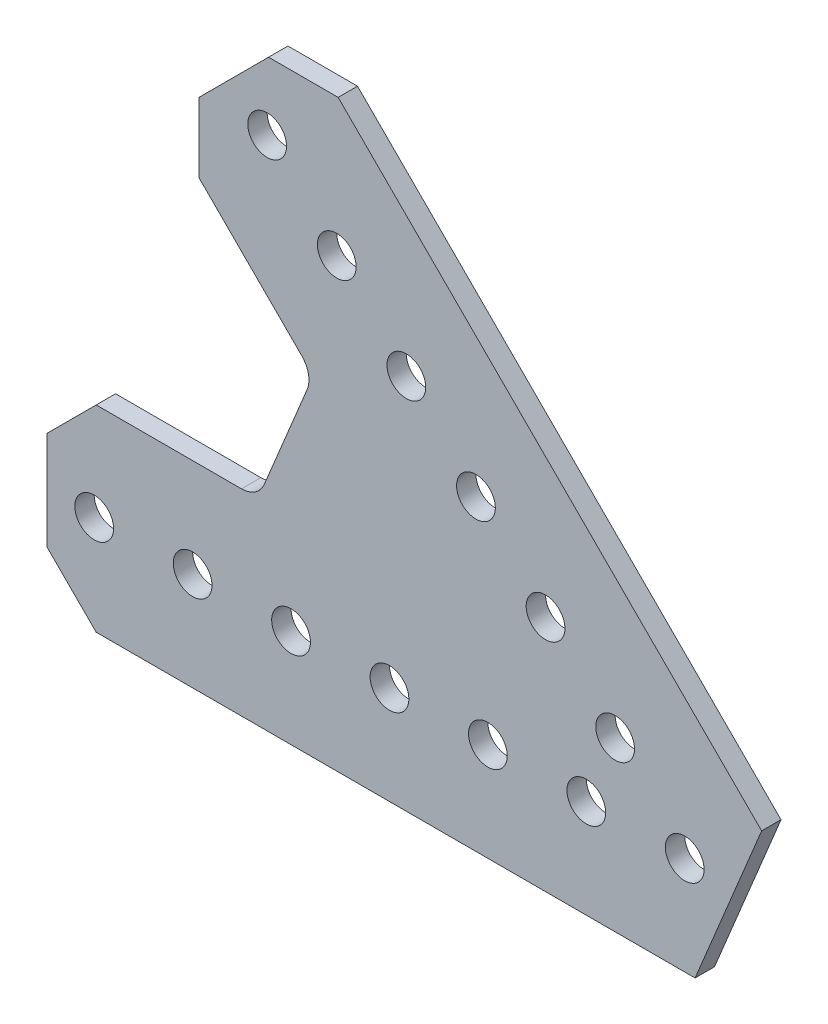
from build123d import *

# Parameters (mm, degrees)
SKETCH1_R           = 2.5
BOSS_EXTRUDE1_DEPTH = 2.5


with BuildPart() as part:
    # Sketch1 → Boss-Extrude1 (new body)
    with BuildSketch(Plane(origin=(0, 0, -1.25), x_dir=(-1, 0, 0), z_dir=(0, 0, -1))):
        with BuildLine():
            Line((-1.337750611, -12.7), (75.946, -12.7))
            Line((75.946, -12.7), (82.296, -6.35))
            Line((82.296, -6.35), (82.296, 6.35))
            Line((82.296, 6.35), (75.946, 12.7))
            Line((75.946, 12.7), (57.193204579, 12.7))
            ThreePointArc((57.193204579, 12.7), (55.429269089, 13.235083981), (54.259887063, 14.659980102))
            Line((54.259887063, 14.659980102), (48.733705431, 28.001362746))
            ThreePointArc((48.733705431, 28.001362746), (48.553029681, 29.835794416), (49.421958916, 31.461446674))
            Line((49.421958916, 31.461446674), (62.682187725, 44.721675483))
            Line((62.682187725, 44.721675483), (62.682187725, 53.701931604))
            Line((62.682187725, 53.701931604), (53.701931604, 62.682187725))
            Line((53.701931604, 62.682187725), (44.721675483, 62.682187725))
            Line((44.721675483, 62.682187725), (-9.92618865, 8.034323593))
            Line((-9.92618865, 8.034323593), (-1.337750611, -12.7))
        make_face()
        with Locations(Location((12.7, 0, 0), (0, 0, 180))):
            Circle(SKETCH1_R, mode=Mode.SUBTRACT)
        with Locations(Location((25.4, 0, 0), (0, 0, 180))):
            Circle(SKETCH1_R, mode=Mode.SUBTRACT)
        with Locations(Location((38.1, 0, 0), (0, 0, 180))):
            Circle(SKETCH1_R, mode=Mode.SUBTRACT)
        with Locations(Location((50.8, 0, 0), (0, 0, 180))):
            Circle(SKETCH1_R, mode=Mode.SUBTRACT)
        with Locations(Location((0, 0, 0), (0, 0, 180))):
            Circle(SKETCH1_R, mode=Mode.SUBTRACT)
        with Locations(Location((76.2, 0, 0), (0, 0, 180))):
            Circle(SKETCH1_R, mode=Mode.SUBTRACT)
        with Locations(Location((63.5, 0, 0), (0, 0, 180))):
            Circle(SKETCH1_R, mode=Mode.SUBTRACT)
        with Locations(Location((53.881536726, 53.881536726, 0), (0, 0, 180))):
            Circle(SKETCH1_R, mode=Mode.SUBTRACT)
        with Locations(Location((44.901280605, 44.901280605, 0), (0, 0, 180))):
            Circle(SKETCH1_R, mode=Mode.SUBTRACT)
        with Locations(Location((35.921024484, 35.921024484, 0), (0, 0, 180))):
            Circle(SKETCH1_R, mode=Mode.SUBTRACT)
        with Locations(Location((26.940768363, 26.940768363, 0), (0, 0, 180))):
            Circle(SKETCH1_R, mode=Mode.SUBTRACT)
        with Locations(Location((17.960512242, 17.960512242, 0), (0, 0, 180))):
            Circle(SKETCH1_R, mode=Mode.SUBTRACT)
        with Locations(Location((8.980256121, 8.980256121, 0), (0, 0, 180))):
            Circle(SKETCH1_R, mode=Mode.SUBTRACT)
    extrude(amount=-BOSS_EXTRUDE1_DEPTH)


solid = part.part
